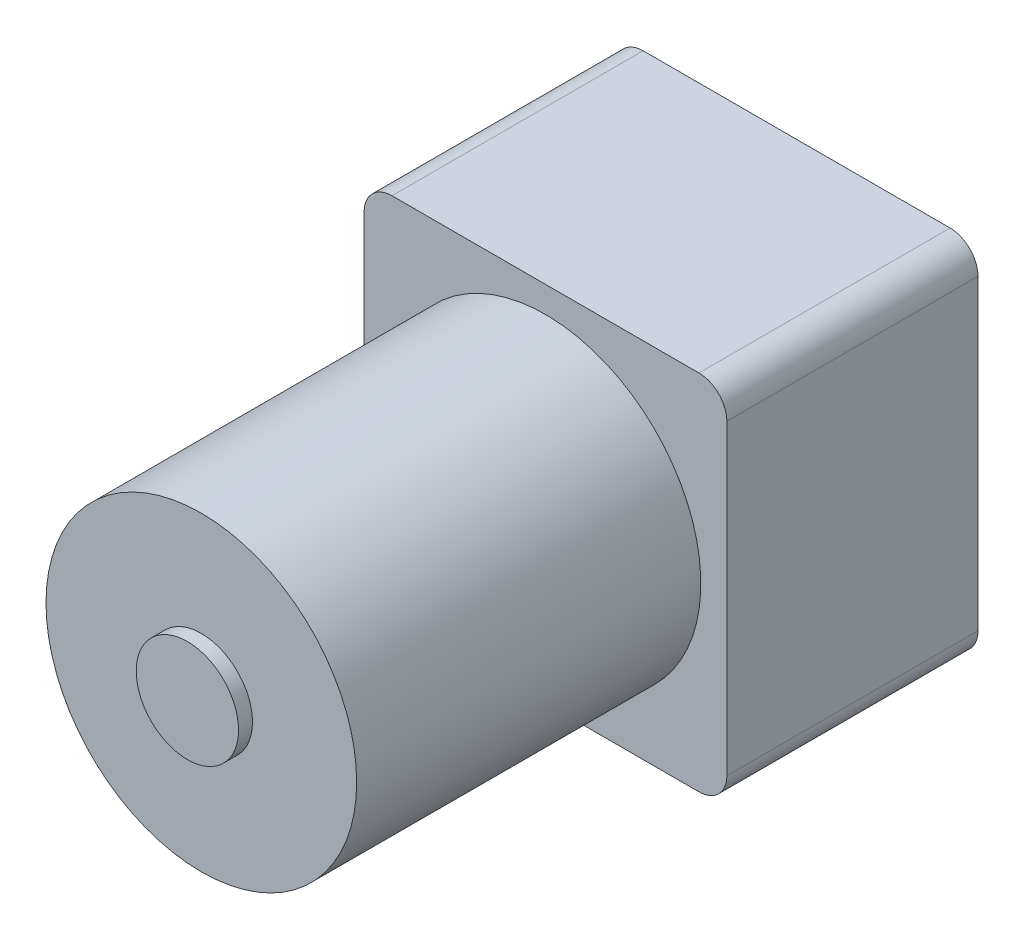
from build123d import *

# Parameters (mm, degrees)
EXTRUSION1_DEPTH = 27
ESQUISSE2_R      = 16.7
EXTRUSION2_DEPTH = 37
ESQUISSE3_R      = 5.5
EXTRUSION3_DEPTH = 1.5
ESQUISSE4_R      = 1.35
EXTRUSION4_DEPTH = 10
EXTRUSION5_START = 1.5
ESQUISSE5_R      = 5.5
EXTRUSION5_DEPTH = 1.5
ESQUISSE6_R      = 2
EXTRUSION6_DEPTH = 8.5


with BuildPart() as part:
    # Esquisse1 → Extrusion1 (new body)
    with BuildSketch(Plane.XY):
        with BuildLine():
            Line((-21.263539738, 17.051170213), (11.736460262, 17.051170213))
            ThreePointArc((11.736460262, 17.051170213), (13.857780605, 16.172490556), (14.736460262, 14.051170213))
            Line((14.736460262, 14.051170213), (14.736460262, -18.948829787))
            ThreePointArc((14.736460262, -18.948829787), (13.857780605, -21.070150131), (11.736460262, -21.948829787))
            Line((11.736460262, -21.948829787), (-21.263539738, -21.948829787))
            ThreePointArc((-21.263539738, -21.948829787), (-23.384860082, -21.070150131), (-24.263539738, -18.948829787))
            Line((-24.263539738, -18.948829787), (-24.263539738, 14.051170213))
            ThreePointArc((-24.263539738, 14.051170213), (-23.384860082, 16.172490556), (-21.263539738, 17.051170213))
        make_face()
    extrude(amount=EXTRUSION1_DEPTH)

    # Esquisse2 → Extrusion2 (add)
    with BuildSketch(Plane.XY.offset(27)):
        with Locations(Location((-4.763539738, -2.448829787, 0), (0, 0, 180))):
            Circle(ESQUISSE2_R)
    extrude(amount=EXTRUSION2_DEPTH)

    # Esquisse3 → Extrusion3 (add)
    with BuildSketch(Plane.XY.offset(64)):
        with Locations((-4.763539738, -2.448829787)):
            Circle(ESQUISSE3_R)
    extrude(amount=EXTRUSION3_DEPTH)

    # Esquisse4 → Extrusion4 (cut)
    with BuildSketch(Plane(origin=(0, 0, 0), x_dir=(-1, 0, 0), z_dir=(0, 0, -1))):
        with Locations((-11.236460262, 13.551170213)):
            Circle(ESQUISSE4_R)
        with Locations((20.763539738, 13.551170213)):
            Circle(ESQUISSE4_R)
        with Locations((20.763539738, -18.448829787)):
            Circle(ESQUISSE4_R)
        with Locations((-11.236460262, -18.448829787)):
            Circle(ESQUISSE4_R)
    extrude(amount=-EXTRUSION4_DEPTH, mode=Mode.SUBTRACT)

    # Esquisse5 → Extrusion5 (add)
    with BuildSketch(Plane(origin=(0, 0, 0), x_dir=(-1, 0, 0), z_dir=(0, 0, -1)).offset(EXTRUSION5_START)):
        with Locations(Location((4.763539738, -2.448829787, 0), (0, 0, 180))):
            Circle(ESQUISSE5_R)
    extrude(amount=-EXTRUSION5_DEPTH)

    # Esquisse6 → Extrusion6 (add)
    with BuildSketch(Plane(origin=(0, 0, -1.5), x_dir=(-1, 0, 0), z_dir=(0, 0, -1))):
        with Locations((4.763539738, -2.448829787)):
            Circle(ESQUISSE6_R)
    extrude(amount=EXTRUSION6_DEPTH)


solid = part.part
